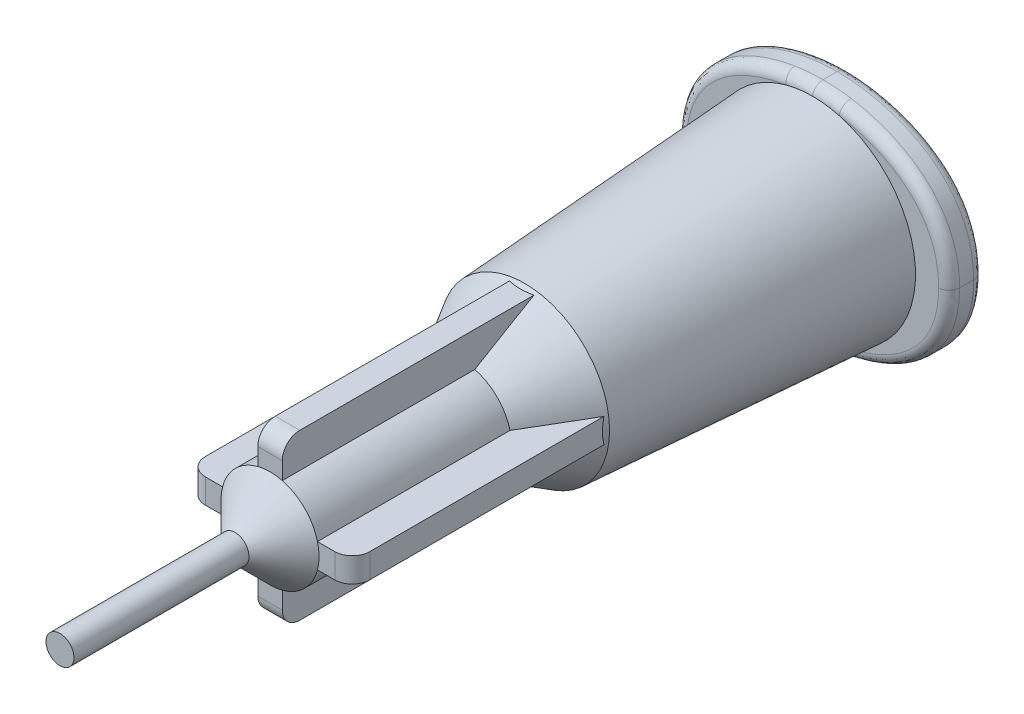
from build123d import *

# Parameters (mm, degrees)
BOSS_EXTRUDE1_DEPTH = 0.35
CIRPATTERN1_COUNT   = 4
SKETCH4_R           = 5.5
CUT_EXTRUDE2_DEPTH  = 18.397413601
FILLET1_R           = 0.3
SKETCH6_W           = 0.4
SKETCH6_H           = 5
FILLET2_R           = 0.5


with BuildPart() as part:
    # Sketch1 → Revolve1 (revolve)
    with BuildSketch(Plane(origin=(0, 0, 0), x_dir=(1, 0, 0), z_dir=(0, 1, 0))):
        Polygon((2.5, 0), (3, 0), (3.9, 0), (3.9, -1), (2.938475611, -1), (2.424366542, -9.225745104), (1.4, -11), (1.4, -16.5), (0.4, -16.5), (0.4, -8), (2, -8), align=None)
    revolve(axis=Axis((0, 0, 16.5), (0, 0, -1)))

    # Sketch2 → Boss-Extrude1 (add, symmetric)
    with BuildSketch(Plane(origin=(0, 0, 0), x_dir=(1, 0, 0), z_dir=(0, 1, 0))):
        Polygon((2.35, -9.094744112), (1.25, -11), (1.25, -16.5), (2.35, -16.5), align=None)
    boss_extrude1 = extrude(amount=BOSS_EXTRUDE1_DEPTH, both=True)

    # CirPattern1: Boss-Extrude1 ×4 about axis
    cirpattern1_axis = Axis((0, 0, 0), (0, 0, 1))
    for i in range(1, CIRPATTERN1_COUNT):
        add(boss_extrude1.rotate(cirpattern1_axis, i * 360 / CIRPATTERN1_COUNT))

    # Sketch4 → Cut-Extrude2 (cut, through all)
    with BuildSketch(Plane(origin=(0, 0, 0), x_dir=(-1, 0, 0), z_dir=(0, 0, -1))):
        Circle(SKETCH4_R)
        with BuildLine():
            add(Edge.make_bspline(
                [(0, 3.2), (-1.681599767, 3.2), (-3.9, 2.322621385), (-3.9, 0)],
                knots=[0, 0, 0, 0, 1, 1, 1, 1], degree=3))
            add(Edge.make_bspline(
                [(0, -3.2), (-1.681599767, -3.2), (-3.9, -2.322621385), (-3.9, 0)],
                knots=[0, 0, 0, 0, 1, 1, 1, 1], degree=3))
            add(Edge.make_bspline(
                [(0, -3.2), (1.681599767, -3.2), (3.9, -2.322621385), (3.9, 0)],
                knots=[0, 0, 0, 0, 1, 1, 1, 1], degree=3))
            add(Edge.make_bspline(
                [(0, 3.2), (1.681599767, 3.2), (3.9, 2.322621385), (3.9, 0)],
                knots=[0, 0, 0, 0, 1, 1, 1, 1], degree=3))
        make_face(mode=Mode.SUBTRACT)
    extrude(amount=-CUT_EXTRUDE2_DEPTH, mode=Mode.SUBTRACT)

    # Fillet1
    fillet1_edges = [part.edges().sort_by_distance(p)[0] for p in [
        (2.666281983, -2.412027807, 0),
        (-2.666281983, -2.412027807, 0),
        (-2.666281983, 2.412027807, 0),
        (2.666281983, 2.412027807, 0),
        (2.666282105, -2.412027711, 1),
        (-2.666282105, -2.412027711, 1),
        (-2.666282105, 2.412027711, 1),
        (2.666282105, 2.412027711, 1),
    ]]
    fillet(fillet1_edges, radius=FILLET1_R)

    # Sketch5 → Revolve2 (revolve)
    with BuildSketch(Plane(origin=(0, 0, 0), x_dir=(1, 0, 0), z_dir=(0, 1, 0)), mode=Mode.PRIVATE) as revolve2_sk:
        Polygon((0, -16.5), (1.4, -16.5), (0.4, -17.5), (0, -17.5), align=None)
    revolve(revolve2_sk.sketch.rotate(Axis((0, 0, 0), (0, 0, 1)), 171.528954844), axis=Axis((0, 0, 0), (0, 0, 1)))

    # Sketch6 → Revolve3 (revolve)
    with BuildSketch(Plane(origin=(0, 0, 0), x_dir=(1, 0, 0), z_dir=(0, 1, 0)), mode=Mode.PRIVATE) as revolve3_sk:
        with Locations((0.2, -20)):
            Rectangle(SKETCH6_W, SKETCH6_H)
    revolve(revolve3_sk.sketch.rotate(Axis((0, 0, 22.5), (0, 0, -1)), 188.471045156), axis=Axis((0, 0, 22.5), (0, 0, -1)))

    # Fillet2
    fillet2_edges = [part.edges().sort_by_distance(p)[0] for p in [
        (2.35, 0, 16.5),
        (0, 2.35, 16.5),
        (-2.35, 0, 16.5),
        (0, -2.35, 16.5),
    ]]
    fillet(fillet2_edges, radius=FILLET2_R)


solid = part.part
